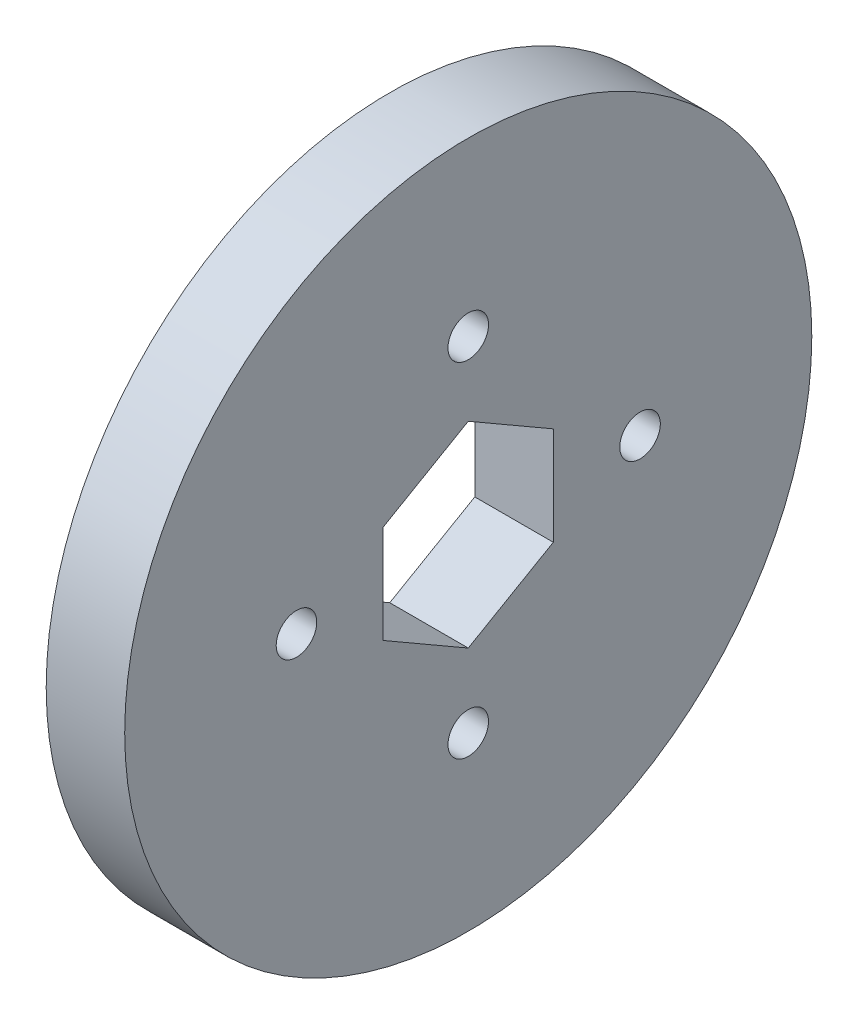
from build123d import *

# Parameters (mm, degrees)
ESQUISSE1_R        = 26.257549031
ESQUISSE1_R_2      = 1.55
BOSS_EXTRU_1_DEPTH = 6


with BuildPart() as part:
    # Esquisse1 → Boss.-Extru.1 (new body)
    with BuildSketch(Plane.ZY):
        with Locations((16.097760006, -58.545962001)):
            Circle(ESQUISSE1_R)
        with Locations((29.226534372, -58.545962001)):
            Circle(ESQUISSE1_R_2, mode=Mode.SUBTRACT)
        with Locations((16.097760006, -45.417187634)):
            Circle(ESQUISSE1_R_2, mode=Mode.SUBTRACT)
        with Locations((2.968985639, -58.545962001)):
            Circle(ESQUISSE1_R_2, mode=Mode.SUBTRACT)
        with Locations((16.097760006, -71.674736367)):
            Circle(ESQUISSE1_R_2, mode=Mode.SUBTRACT)
        Polygon((16.097760006, -51.040408501), (9.597760006, -54.793185251), (9.597760006, -62.29873875), (16.097760006, -66.0515155), (22.597760006, -62.29873875), (22.597760006, -54.793185251), align=None, mode=Mode.SUBTRACT)
    extrude(amount=BOSS_EXTRU_1_DEPTH)


solid = part.part
